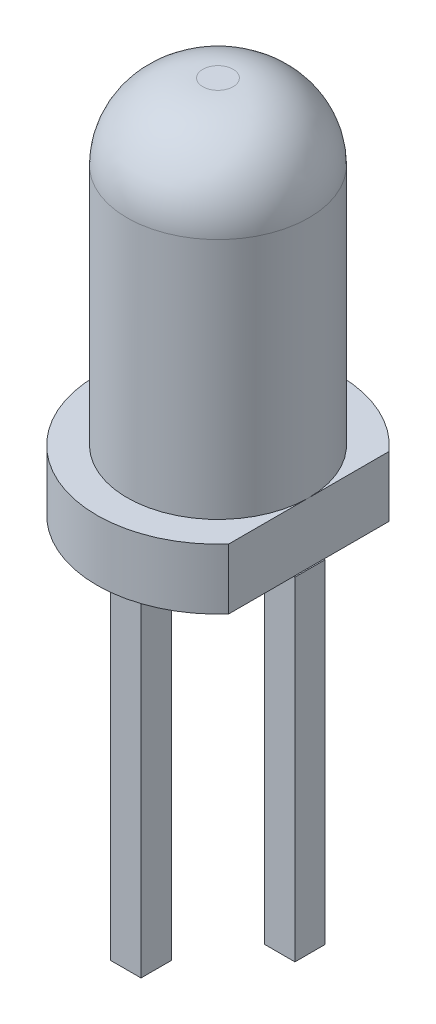
from build123d import *

# Parameters (mm, degrees)
CROQUIS1_R           = 2
BASE_DEPTH           = 1
CROQUIS2_R           = 1.5
CUERPO_DEL_LED_DEPTH = 5.25
CROQUIS3_W           = 0.5
CROQUIS3_H           = 0.5
PINES_DEPTH          = 7
CROQUIS4_W           = 0.5
CROQUIS4_H           = 0.5
CORTE_A_CATODO_DEPTH = 1.5
CROQUIS6_W           = 1
CROQUIS6_H           = 4.5
RANURA_DEPTH         = 1
PUNTA_DEL_LED_R      = 1.25


with BuildPart() as part:
    # Croquis1 → Base (new body)
    with BuildSketch(Plane(origin=(0, 0, 0), x_dir=(1, 0, 0), z_dir=(0, 1, 0))):
        with Locations(Location((0, 0, 0), (0, 0, 270))):
            Circle(CROQUIS1_R)
    extrude(amount=BASE_DEPTH)

    # Croquis2 → Cuerpo del LED (add)
    with BuildSketch(Plane(origin=(0, 1, 0), x_dir=(1, 0, 0), z_dir=(0, 1, 0))):
        with Locations(Location((0, 0, 0), (0, 0, 90))):
            Circle(CROQUIS2_R)
    extrude(amount=CUERPO_DEL_LED_DEPTH)

    # Croquis3 → Pines (add)
    with BuildSketch(Plane.XZ):
        with Locations((-1.270142923, 0)):
            Rectangle(CROQUIS3_W, CROQUIS3_H)
        with Locations((1.270172723, 0)):
            Rectangle(CROQUIS3_W, CROQUIS3_H)
    extrude(amount=PINES_DEPTH)

    # Croquis4 → Corte a Catodo (cut)
    with BuildSketch(Plane.XZ.offset(7)):
        with Locations((1.270172723, 0)):
            Rectangle(CROQUIS4_W, CROQUIS4_H)
    extrude(amount=-CORTE_A_CATODO_DEPTH, mode=Mode.SUBTRACT)

    # Croquis6 → Ranura (cut)
    with BuildSketch(Plane(origin=(0, 1, 0), x_dir=(1, 0, 0), z_dir=(0, 1, 0))):
        with Locations((2, 0.48044739)):
            Rectangle(CROQUIS6_W, CROQUIS6_H)
    extrude(amount=-RANURA_DEPTH, mode=Mode.SUBTRACT)

    # Punta del Led
    punta_del_led_edges = [part.edges().sort_by_distance(p)[0] for p in [
        (0, 6.25, 1.5),
    ]]
    fillet(punta_del_led_edges, radius=PUNTA_DEL_LED_R)


solid = part.part
